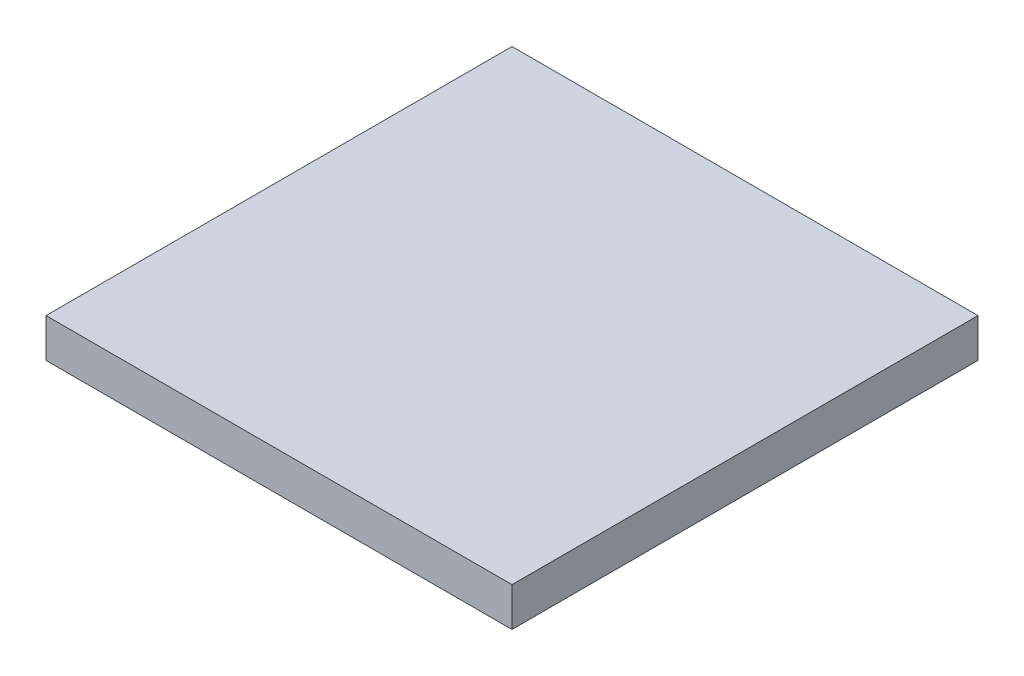
from build123d import *

# Parameters (mm, degrees)
SKETCH_1_W      = 120
SKETCH_1_H      = 120
EXTRUDE_1_DEPTH = 10


with BuildPart() as part:
    # 草图1 → 凸台-拉伸1 (new body)
    with BuildSketch(Plane(origin=(0, 0, 0), x_dir=(1, 0, 0), z_dir=(0, 1, 0))):
        with Locations((60, -60)):
            Rectangle(SKETCH_1_W, SKETCH_1_H)
    extrude(amount=EXTRUDE_1_DEPTH)


solid = part.part
